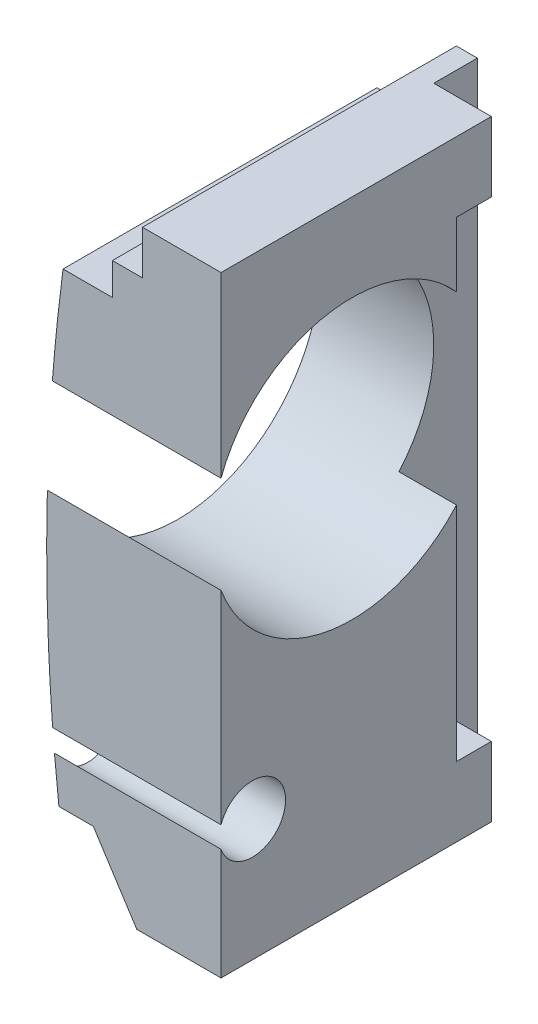
from build123d import *

# Parameters (mm, degrees)
Y_KSEKLIK_EKSTR_ZYON1_DEPTH = 18
IZIM2_W                     = 4.932789915
IZIM2_H                     = 2.5
KES_EKSTR_ZYON1_DEPTH       = 50
IZIM3_R                     = 1.9
KES_EKSTR_ZYON2_DEPTH       = 50
IZIM5_W                     = 2
IZIM5_H                     = 27.034765158
KES_EKSTR_ZYON6_DEPTH       = 3.301675079
IZIM4_R                     = 8
KES_EKSTR_ZYON5_DEPTH       = 50


with BuildPart() as part:
    # Çizim1 → Yükseklik-Ekstrüzyon1 (new body)
    with BuildSketch(Plane.XY):
        with BuildLine():
            Line((-29.072656292, 30.398231235), (-27.345449894, 30.398231235))
            Line((-27.345449894, 30.398231235), (-27.345449894, 32.915968723))
            Line((-27.345449894, 32.915968723), (-22.842394814, 32.915968723))
            Line((-22.842394814, 32.915968723), (-22.842394814, -2.118796435))
            Line((-22.842394814, -2.118796435), (-27.674756319, -2.118796435))
            Line((-27.674756319, -2.118796435), (-30.167426941, 1.750867772))
            Line((-30.167426941, 1.750867772), (-32.139817972, 1.750867772))
            add(Edge.make_bspline(
                [(-32.139817972, 1.750867772), (-32.495187753, 4.885906141), (-32.864718894, 10.152165336), (-32.849440261, 19.124114906), (-32.38234085, 24.914837942), (-31.903618641, 28.562636684)],
                knots=[0.015716623, 0.015716623, 0.015716623, 0.015716623, 0.357537263, 0.585417689, 0.984003614, 0.984003614, 0.984003614, 0.984003614], degree=3))
            Line((-31.903618641, 28.562636684), (-29.072656292, 28.562636684))
            Line((-29.072656292, 28.562636684), (-29.072656292, 30.398231235))
        make_face()
    extrude(amount=Y_KSEKLIK_EKSTR_ZYON1_DEPTH)

    # Çizim2 → Kes-Ekstrüzyon1 (cut)
    with BuildSketch(Plane(origin=(0, -2.118796435, 0), x_dir=(-1, 0, 0), z_dir=(0, -1, 0))):
        with Locations((23.677674935, -1.25)):
            Rectangle(IZIM2_W, IZIM2_H)
    extrude(amount=-KES_EKSTR_ZYON1_DEPTH, mode=Mode.SUBTRACT)

    # Çizim3 → Kes-Ekstrüzyon2 (cut)
    with BuildSketch(Plane(origin=(-22.842394814, 0, 0), x_dir=(0, 0, -1), z_dir=(1, 0, 0))):
        with Locations((-16.2, 4.881203565)):
            Circle(IZIM3_R)
    extrude(amount=-KES_EKSTR_ZYON2_DEPTH, mode=Mode.SUBTRACT)

    # Çizim5 → Kes-Ekstrüzyon6 (cut)
    with BuildSketch(Plane(origin=(-22.842394814, 0, 0), x_dir=(0, 0, -1), z_dir=(1, 0, 0))):
        with Locations((-3.5, 15.398586144)):
            Rectangle(IZIM5_W, IZIM5_H)
    extrude(amount=-KES_EKSTR_ZYON6_DEPTH, mode=Mode.SUBTRACT)

    # Çizim4 → Kes-Ekstrüzyon5 (cut)
    with BuildSketch(Plane(origin=(-22.842394814, 0, 0), x_dir=(0, 0, -1), z_dir=(1, 0, 0))):
        with Locations((-10.5, 19.915968723)):
            Circle(IZIM4_R)
    extrude(amount=-KES_EKSTR_ZYON5_DEPTH, mode=Mode.SUBTRACT)


solid = part.part
